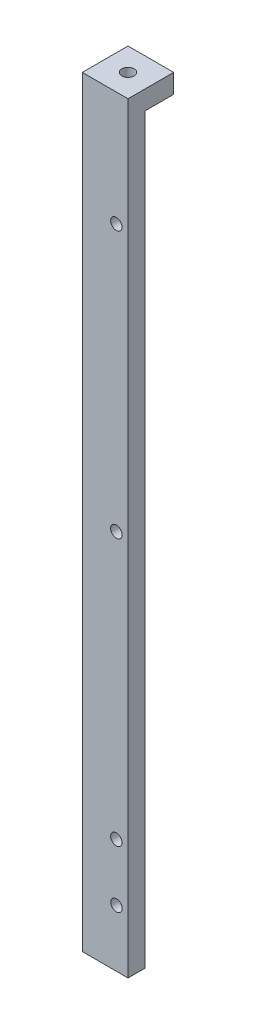
from build123d import *

# Parameters (mm, degrees)
BOSS_EXTRUDE1_DEPTH = 200
SKETCH2_W           = 12
SKETCH2_H           = 12
BOSS_EXTRUDE2_DEPTH = 5
SKETCH3_R           = 1.625
CUT_EXTRUDE1_DEPTH  = 15
CUT_EXTRUDE3_START  = -3
SKETCH6_R           = 3
CUT_EXTRUDE3_DEPTH  = 15
SKETCH7_R           = 1.5
CUT_EXTRUDE4_DEPTH  = 8
SKETCH8_R           = 1.5
CUT_EXTRUDE5_DEPTH  = 8


with BuildPart() as part:
    # Sketch1 → Boss-Extrude1 (new body)
    with BuildSketch(Plane(origin=(0, 0, 0), x_dir=(1, 0, 0), z_dir=(0, 1, 0))):
        with BuildLine():
            Line((-6, 6), (-1.5, 6))
            Line((-1.5, 6), (-1.5, 0))
            ThreePointArc((-1.5, 0), (-1.060660172, -1.060660172), (0, -1.5))
            Line((0, -1.5), (6, -1.5))
            Line((6, -1.5), (6, -6))
            Line((6, -6), (-6, -6))
            Line((-6, -6), (-6, 6))
        make_face()
    extrude(amount=BOSS_EXTRUDE1_DEPTH)

    # Sketch2 → Boss-Extrude2 (add)
    with BuildSketch(Plane(origin=(0, 200, 0), x_dir=(1, 0, 0), z_dir=(0, 1, 0))):
        Rectangle(SKETCH2_W, SKETCH2_H)
    extrude(amount=-BOSS_EXTRUDE2_DEPTH)

    # Sketch3 → Cut-Extrude1 (cut)
    with BuildSketch(Plane(origin=(0, 200, 0), x_dir=(1, 0, 0), z_dir=(0, 1, 0))):
        with Locations(Location((0, 0, 0), (0, 0, 270))):
            Circle(SKETCH3_R)
    extrude(amount=-CUT_EXTRUDE1_DEPTH, mode=Mode.SUBTRACT)

    # Sketch6 → Cut-Extrude3 (cut)
    with BuildSketch(Plane(origin=(0, 200, 0), x_dir=(1, 0, 0), z_dir=(0, 1, 0)).offset(CUT_EXTRUDE3_START)):
        with Locations(Location((0, 0, 0), (0, 0, 270))):
            Circle(SKETCH6_R)
    extrude(amount=-CUT_EXTRUDE3_DEPTH, mode=Mode.SUBTRACT)

    # Sketch7 → Cut-Extrude4 (cut)
    with BuildSketch(Plane(origin=(0, 0, 1.5), x_dir=(-1, 0, 0), z_dir=(0, 0, -1))):
        with Locations((-2.933748826, 30)):
            Circle(SKETCH7_R)
        with Locations((-2.933748826, 100)):
            Circle(SKETCH7_R)
        with Locations((-2.933748826, 170)):
            Circle(SKETCH7_R)
        with Locations((-2.966874413, 15)):
            Circle(SKETCH7_R)
    extrude(amount=-CUT_EXTRUDE4_DEPTH, mode=Mode.SUBTRACT)

    # Sketch8 → Cut-Extrude5 (cut)
    with BuildSketch(Plane(origin=(-1.5, 0, 0), x_dir=(0, 0, -1), z_dir=(1, 0, 0))):
        with Locations((2.938165571, 30)):
            Circle(SKETCH8_R)
        with Locations((2.938165571, 100)):
            Circle(SKETCH8_R)
        with Locations((2.938165571, 170)):
            Circle(SKETCH8_R)
        with Locations((2.966874413, 15)):
            Circle(SKETCH8_R)
    extrude(amount=-CUT_EXTRUDE5_DEPTH, mode=Mode.SUBTRACT)


solid = part.part
